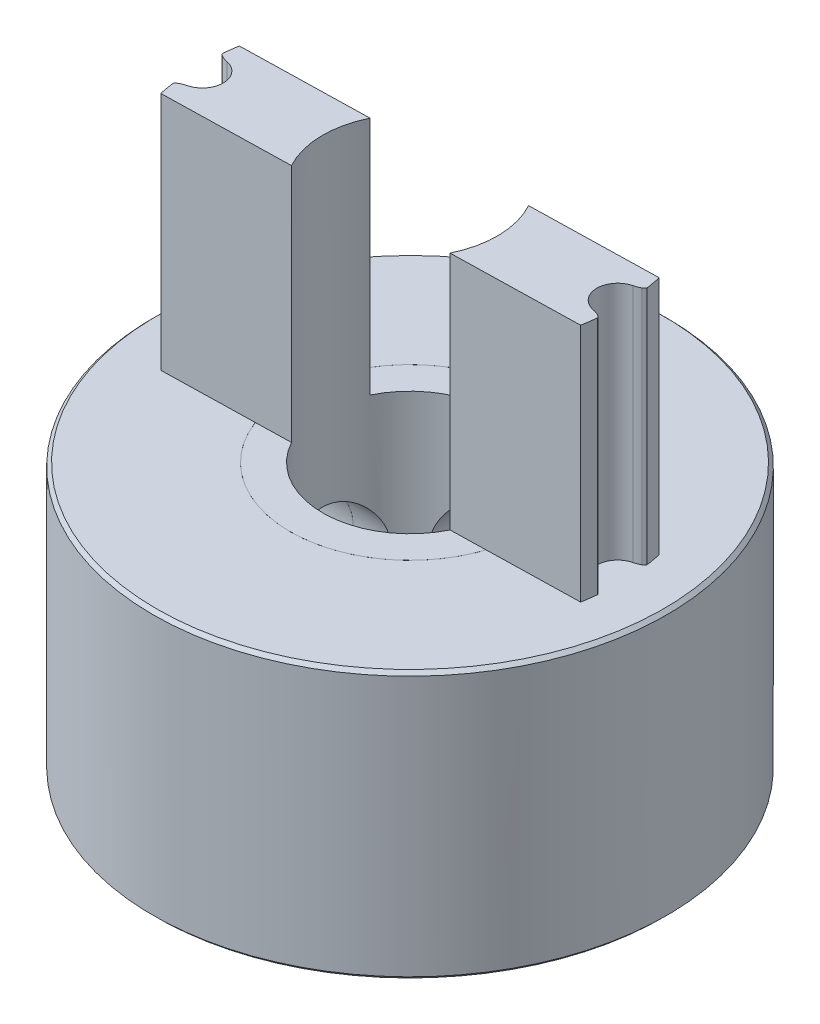
from build123d import *
from build123d.topology import SkipClean

# Parameters (mm, degrees)
P_IDAT_START            = 7.8
SKICA1_R                = 2.5
P_IDAT_VYSUNUT_M1_DEPTH = 7
SKICA2_R                = 3.5
SKICA2_R_2              = 2.5
P_IDAT_VYSUNUT_M2_DEPTH = 7.8
SKICA6_R                = 7.5
SKICA6_R_2              = 3.5
P_IDAT_VYSUNUT_M5_DEPTH = 7.8
ZKOSEN_3_SIZE           = 0.1
SKETCH19_R              = 1.5
CUT_EXTRUDE6_DEPTH      = 8
SKETCH20_R              = 1.5
CUT_EXTRUDE7_DEPTH      = 8
SKETCH21_R              = 2.55
CUT_EXTRUDE8_DEPTH      = 30
CUT_EXTRUDE9_DEPTH      = 7


with BuildPart() as part:
    # Skica1 → Přidat vysunutím1 (new body)
    with BuildSketch(Plane(origin=(0, 0, 0), x_dir=(1, 0, 0), z_dir=(0, 1, 0)).offset(P_IDAT_START)):
        with BuildLine():
            ThreePointArc((-5.730143195, 1.098270155), (-5.09645097, 1.530497044), (-5.387174672, 2.240331989))
            ThreePointArc((-5.387174672, 2.240331989), (-5.468060657, 2.292707421), (-5.540463547, 2.356296335))
            ThreePointArc((-5.540463547, 2.356296335), (-5.573874331, 2.399596558), (-5.596043873, 2.44959357))
            ThreePointArc((-5.596043873, 2.44959357), (-5.50369925, 2.650567912), (-5.404139771, 2.848067596))
            ThreePointArc((-5.404139771, 2.848067596), (-5.351227535, 2.86190541), (-5.296542742, 2.862779021))
            ThreePointArc((-5.296542742, 2.862779021), (-5.201685094, 2.845815675), (-5.110305882, 2.815228615))
            ThreePointArc((-5.110305882, 2.815228615), (-4.374063308, 3.030479148), (-4.431206919, 3.795410862))
            ThreePointArc((-4.431206919, 3.795410862), (-4.491949163, 3.870218002), (-4.541158349, 3.953068377))
            ThreePointArc((-4.541158349, 3.953068377), (-4.559553388, 4.004573836), (-4.565187949, 4.058974585))
            ThreePointArc((-4.565187949, 4.058974585), (-4.415258506, 4.221576484), (-4.259541056, 4.378644275))
            ThreePointArc((-4.259541056, 4.378644275), (-4.204942409, 4.375454038), (-4.15266412, 4.359386362))
            ThreePointArc((-4.15266412, 4.359386362), (-4.067691098, 4.313940635), (-3.990236225, 4.256612884))
            ThreePointArc((-3.990236225, 4.256612884), (-3.223511854, 4.233816838), (-3.041481758, 4.978968476))
            ThreePointArc((-3.041481758, 4.978968476), (-3.076134388, 5.06888468), (-3.097332931, 5.162886543))
            ThreePointArc((-3.097332931, 5.162886543), (-3.09891159, 5.217555525), (-3.08745962, 5.271034888))
            ThreePointArc((-3.08745962, 5.271034888), (-2.894621497, 5.379347737), (-2.697988784, 5.480608745))
            ThreePointArc((-2.697988784, 5.480608745), (-2.647048223, 5.460702739), (-2.6022938, 5.429266591))
            ThreePointArc((-2.6022938, 5.429266591), (-2.535523156, 5.359787029), (-2.479574443, 5.281330225))
            ThreePointArc((-2.479574443, 5.281330225), (-1.7574206, 5.022719037), (-1.354035171, 5.675149965))
            ThreePointArc((-1.354035171, 5.675149965), (-1.359206146, 5.771373608), (-1.350318985, 5.867325402))
            ThreePointArc((-1.350318985, 5.867325402), (-1.334926735, 5.919806527), (-1.307509232, 5.967129569))
            ThreePointArc((-1.307509232, 5.967129569), (-1.090638767, 6.010550954), (-0.872338572, 6.046093045))
            ThreePointArc((-0.872338572, 6.046093045), (-0.830042514, 6.01141981), (-0.797192832, 5.967692379))
            ThreePointArc((-0.797192832, 5.967692379), (-0.755160541, 5.880980125), (-0.726194639, 5.789074167))
            ThreePointArc((-0.726194639, 5.789074167), (-0.119300773, 5.319962501), (0.465953812, 5.815808234))
            ThreePointArc((0.465953812, 5.815808234), (0.490770664, 5.908920276), (0.528873591, 5.997429571))
            ThreePointArc((0.528873591, 5.997429571), (0.55973005, 6.04258562), (0.600429269, 6.079120034))
            ThreePointArc((0.600429269, 6.079120034), (0.820103284, 6.053399565), (1.038702217, 6.019743632))
            ThreePointArc((1.038702217, 6.019743632), (1.06821354, 5.973697225), (1.085942924, 5.921958857))
            ThreePointArc((1.085942924, 5.921958857), (1.099122448, 5.826501911), (1.098270155, 5.730143195))
            ThreePointArc((1.098270155, 5.730143195), (1.530497044, 5.09645097), (2.240331989, 5.387174672))
            ThreePointArc((2.240331989, 5.387174672), (2.292707421, 5.468060657), (2.356296335, 5.540463547))
            ThreePointArc((2.356296335, 5.540463547), (2.399596558, 5.573874331), (2.44959357, 5.596043873))
            ThreePointArc((2.44959357, 5.596043873), (2.650567912, 5.50369925), (2.848067596, 5.404139771))
            ThreePointArc((2.848067596, 5.404139771), (2.86190541, 5.351227535), (2.862779021, 5.296542742))
            ThreePointArc((2.862779021, 5.296542742), (2.845815675, 5.201685094), (2.815228615, 5.110305882))
            ThreePointArc((2.815228615, 5.110305882), (3.030479148, 4.374063308), (3.795410862, 4.431206919))
            ThreePointArc((3.795410862, 4.431206919), (3.870218002, 4.491949163), (3.953068377, 4.541158349))
            ThreePointArc((3.953068377, 4.541158349), (4.004573836, 4.559553388), (4.058974585, 4.565187949))
            ThreePointArc((4.058974585, 4.565187949), (4.221576484, 4.415258506), (4.378644275, 4.259541056))
            ThreePointArc((4.378644275, 4.259541056), (4.375454038, 4.204942409), (4.359386362, 4.15266412))
            ThreePointArc((4.359386362, 4.15266412), (4.313940635, 4.067691098), (4.256612884, 3.990236225))
            ThreePointArc((4.256612884, 3.990236225), (4.233816838, 3.223511854), (4.978968476, 3.041481758))
            ThreePointArc((4.978968476, 3.041481758), (5.06888468, 3.076134388), (5.162886543, 3.097332931))
            ThreePointArc((5.162886543, 3.097332931), (5.217555525, 3.09891159), (5.271034888, 3.08745962))
            ThreePointArc((5.271034888, 3.08745962), (5.379347737, 2.894621497), (5.480608745, 2.697988784))
            ThreePointArc((5.480608745, 2.697988784), (5.460702739, 2.647048223), (5.429266591, 2.6022938))
            ThreePointArc((5.429266591, 2.6022938), (5.359787029, 2.535523156), (5.281330225, 2.479574443))
            ThreePointArc((5.281330225, 2.479574443), (5.022719037, 1.7574206), (5.675149965, 1.354035171))
            ThreePointArc((5.675149965, 1.354035171), (5.771373608, 1.359206146), (5.867325402, 1.350318985))
            ThreePointArc((5.867325402, 1.350318985), (5.919806527, 1.334926735), (5.967129569, 1.307509232))
            ThreePointArc((5.967129569, 1.307509232), (6.010550954, 1.090638767), (6.046093045, 0.872338572))
            ThreePointArc((6.046093045, 0.872338572), (6.01141981, 0.830042514), (5.967692379, 0.797192832))
            ThreePointArc((5.967692379, 0.797192832), (5.880980125, 0.755160541), (5.789074167, 0.726194639))
            ThreePointArc((5.789074167, 0.726194639), (5.319962501, 0.119300773), (5.815808234, -0.465953812))
            ThreePointArc((5.815808234, -0.465953812), (5.908920276, -0.490770664), (5.997429571, -0.528873591))
            ThreePointArc((5.997429571, -0.528873591), (6.04258562, -0.55973005), (6.079120034, -0.600429269))
            ThreePointArc((6.079120034, -0.600429269), (6.053399565, -0.820103284), (6.019743632, -1.038702217))
            ThreePointArc((6.019743632, -1.038702217), (5.973697225, -1.06821354), (5.921958857, -1.085942924))
            ThreePointArc((5.921958857, -1.085942924), (5.826501911, -1.099122448), (5.730143195, -1.098270155))
            ThreePointArc((5.730143195, -1.098270155), (5.09645097, -1.530497044), (5.387174672, -2.240331989))
            ThreePointArc((5.387174672, -2.240331989), (5.468060657, -2.292707421), (5.540463547, -2.356296335))
            ThreePointArc((5.540463547, -2.356296335), (5.573874331, -2.399596558), (5.596043873, -2.44959357))
            ThreePointArc((5.596043873, -2.44959357), (5.50369925, -2.650567911), (5.404139771, -2.848067596))
            ThreePointArc((5.404139771, -2.848067596), (5.351227535, -2.86190541), (5.296542742, -2.862779021))
            ThreePointArc((5.296542742, -2.862779021), (5.201685094, -2.845815675), (5.110305882, -2.815228615))
            ThreePointArc((5.110305882, -2.815228615), (4.374063308, -3.030479148), (4.431206919, -3.795410862))
            ThreePointArc((4.431206919, -3.795410862), (4.491949163, -3.870218002), (4.541158349, -3.953068377))
            ThreePointArc((4.541158349, -3.953068377), (4.559553388, -4.004573836), (4.565187949, -4.058974585))
            ThreePointArc((4.565187949, -4.058974585), (4.415258506, -4.221576484), (4.259541056, -4.378644275))
            ThreePointArc((4.259541056, -4.378644275), (4.204942409, -4.375454038), (4.15266412, -4.359386362))
            ThreePointArc((4.15266412, -4.359386362), (4.067691098, -4.313940635), (3.990236225, -4.256612884))
            ThreePointArc((3.990236225, -4.256612884), (3.223511854, -4.233816838), (3.041481758, -4.978968476))
            ThreePointArc((3.041481758, -4.978968476), (3.076134388, -5.06888468), (3.097332931, -5.162886543))
            ThreePointArc((3.097332931, -5.162886543), (3.09891159, -5.217555525), (3.08745962, -5.271034888))
            ThreePointArc((3.08745962, -5.271034888), (2.894621497, -5.379347737), (2.697988784, -5.480608745))
            ThreePointArc((2.697988784, -5.480608745), (2.647048223, -5.460702739), (2.6022938, -5.429266591))
            ThreePointArc((2.6022938, -5.429266591), (2.535523156, -5.359787029), (2.479574443, -5.281330225))
            ThreePointArc((2.479574443, -5.281330225), (1.7574206, -5.022719037), (1.354035171, -5.675149965))
            ThreePointArc((1.354035171, -5.675149965), (1.359206146, -5.771373608), (1.350318985, -5.867325402))
            ThreePointArc((1.350318985, -5.867325402), (1.334926735, -5.919806527), (1.307509232, -5.967129569))
            ThreePointArc((1.307509232, -5.967129569), (1.090638767, -6.010550954), (0.872338572, -6.046093045))
            ThreePointArc((0.872338572, -6.046093045), (0.830042514, -6.01141981), (0.797192832, -5.967692379))
            ThreePointArc((0.797192832, -5.967692379), (0.755160541, -5.880980125), (0.726194639, -5.789074167))
            ThreePointArc((0.726194639, -5.789074167), (0.119300773, -5.319962501), (-0.465953812, -5.815808234))
            ThreePointArc((-0.465953812, -5.815808234), (-0.490770664, -5.908920276), (-0.528873591, -5.997429571))
            ThreePointArc((-0.528873591, -5.997429571), (-0.55973005, -6.04258562), (-0.600429269, -6.079120034))
            ThreePointArc((-0.600429269, -6.079120034), (-0.820103284, -6.053399565), (-1.038702217, -6.019743632))
            ThreePointArc((-1.038702217, -6.019743632), (-1.06821354, -5.973697225), (-1.085942924, -5.921958857))
            ThreePointArc((-1.085942924, -5.921958857), (-1.099122448, -5.826501911), (-1.098270155, -5.730143195))
            ThreePointArc((-1.098270155, -5.730143195), (-1.530497044, -5.09645097), (-2.240331989, -5.387174672))
            ThreePointArc((-2.240331989, -5.387174672), (-2.292707421, -5.468060657), (-2.356296335, -5.540463547))
            ThreePointArc((-2.356296335, -5.540463547), (-2.399596558, -5.573874331), (-2.44959357, -5.596043873))
            ThreePointArc((-2.44959357, -5.596043873), (-2.650567912, -5.50369925), (-2.848067596, -5.404139771))
            ThreePointArc((-2.848067596, -5.404139771), (-2.86190541, -5.351227535), (-2.862779021, -5.296542742))
            ThreePointArc((-2.862779021, -5.296542742), (-2.845815675, -5.201685094), (-2.815228615, -5.110305882))
            ThreePointArc((-2.815228615, -5.110305882), (-3.030479148, -4.374063308), (-3.795410862, -4.431206919))
            ThreePointArc((-3.795410862, -4.431206919), (-3.870218002, -4.491949163), (-3.953068377, -4.541158349))
            ThreePointArc((-3.953068377, -4.541158349), (-4.004573836, -4.559553388), (-4.058974585, -4.565187949))
            ThreePointArc((-4.058974585, -4.565187949), (-4.221576484, -4.415258506), (-4.378644275, -4.259541056))
            ThreePointArc((-4.378644275, -4.259541056), (-4.375454038, -4.204942409), (-4.359386362, -4.15266412))
            ThreePointArc((-4.359386362, -4.15266412), (-4.313940635, -4.067691098), (-4.256612884, -3.990236225))
            ThreePointArc((-4.256612884, -3.990236225), (-4.233816838, -3.223511854), (-4.978968476, -3.041481758))
            ThreePointArc((-4.978968476, -3.041481758), (-5.06888468, -3.076134388), (-5.162886543, -3.097332931))
            ThreePointArc((-5.162886543, -3.097332931), (-5.217555525, -3.09891159), (-5.271034888, -3.08745962))
            ThreePointArc((-5.271034888, -3.08745962), (-5.379347737, -2.894621497), (-5.480608745, -2.697988784))
            ThreePointArc((-5.480608745, -2.697988784), (-5.460702739, -2.647048223), (-5.429266591, -2.6022938))
            ThreePointArc((-5.429266591, -2.6022938), (-5.359787029, -2.535523156), (-5.281330225, -2.479574443))
            ThreePointArc((-5.281330225, -2.479574443), (-5.022719037, -1.7574206), (-5.675149965, -1.354035171))
            ThreePointArc((-5.675149965, -1.354035171), (-5.771373608, -1.359206146), (-5.867325402, -1.350318985))
            ThreePointArc((-5.867325402, -1.350318985), (-5.919806527, -1.334926735), (-5.967129569, -1.307509232))
            ThreePointArc((-5.967129569, -1.307509232), (-6.010550954, -1.090638767), (-6.046093045, -0.872338572))
            ThreePointArc((-6.046093045, -0.872338572), (-6.01141981, -0.830042514), (-5.967692379, -0.797192832))
            ThreePointArc((-5.967692379, -0.797192832), (-5.880980125, -0.755160541), (-5.789074167, -0.726194639))
            ThreePointArc((-5.789074167, -0.726194639), (-5.319962501, -0.119300773), (-5.815808234, 0.465953812))
            ThreePointArc((-5.815808234, 0.465953812), (-5.908920276, 0.490770664), (-5.997429571, 0.528873591))
            ThreePointArc((-5.997429571, 0.528873591), (-6.04258562, 0.55973005), (-6.079120034, 0.600429269))
            ThreePointArc((-6.079120034, 0.600429269), (-6.053399565, 0.820103284), (-6.019743632, 1.038702217))
            ThreePointArc((-6.019743632, 1.038702217), (-5.973697225, 1.06821354), (-5.921958857, 1.085942924))
            ThreePointArc((-5.921958857, 1.085942924), (-5.826501911, 1.099122448), (-5.730143195, 1.098270155))
        make_face()
        with Locations(Location((0, 0, 0), (0, 0, 270))):
            Circle(SKICA1_R, mode=Mode.SUBTRACT)
    extrude(amount=P_IDAT_VYSUNUT_M1_DEPTH)

    # Skica2 → Přidat vysunutím2 (add)
    with SkipClean():  # the faces are left unmerged after this step: merging them gives an invalid solid
        with BuildSketch(Plane.XZ.offset(-7.8).offset(P_IDAT_START)):
            with Locations(Location((0, 0, 0), (0, 0, 90))):
                Circle(SKICA2_R)
            with Locations(Location((0, 0, 0), (0, 0, 270))):
                Circle(SKICA2_R_2, mode=Mode.SUBTRACT)
        extrude(amount=-P_IDAT_VYSUNUT_M2_DEPTH)


with BuildPart() as body_2:
    # Skica6 → Přidat vysunutím5 (new body)
    with BuildSketch(Plane.XZ):
        with Locations(Location((0, 0, 0), (0, 0, 270))):
            Circle(SKICA6_R)
        with Locations(Location((0, 0, 0), (0, 0, 270))):
            Circle(SKICA6_R_2, mode=Mode.SUBTRACT)
    extrude(amount=-P_IDAT_VYSUNUT_M5_DEPTH)

    # Zkosení3
    zkosen_3_edges = [body_2.edges().sort_by_distance(p)[0] for p in [
        (0, 0, 7.5),
        (0, 7.8, 7.5),
    ]]
    chamfer(zkosen_3_edges, length=ZKOSEN_3_SIZE)


with BuildPart() as cut_extrude6_tool:
    # Sketch19 → Cut-Extrude6 (new body)
    with SkipClean():  # the faces are left unmerged after this step: merging them gives an invalid solid
        with BuildSketch(Plane(origin=(0, 0, -7.5), x_dir=(-1, 0, 0), z_dir=(0, 0, -1))):
            with Locations(Location((0, 3.9, 0), (0, 0, 90))):
                Circle(SKETCH19_R)
        extrude(amount=-CUT_EXTRUDE6_DEPTH)


with BuildPart() as part_1:
    with SkipClean():  # the faces are left unmerged after this step: merging them gives an invalid solid
        add(part.part)

        # Cut-Extrude6: cut by cut_extrude6_tool
        add(cut_extrude6_tool.part, mode=Mode.SUBTRACT)


with BuildPart() as body_2_1:
    with SkipClean():  # the faces are left unmerged after this step: merging them gives an invalid solid
        add(body_2.part)

        # Cut-Extrude6: cut by cut_extrude6_tool
        add(cut_extrude6_tool.part, mode=Mode.SUBTRACT)


with BuildPart() as cut_extrude7_tool:
    # Sketch20 → Cut-Extrude7 (new body)
    with SkipClean():  # the faces are left unmerged after this step: merging them gives an invalid solid
        with BuildSketch(Plane.ZY.offset(7.5)):
            with Locations((0, 3.9)):
                Circle(SKETCH20_R)
        extrude(amount=-CUT_EXTRUDE7_DEPTH)


with BuildPart() as part_2:
    with SkipClean():  # the faces are left unmerged after this step: merging them gives an invalid solid
        add(part_1.part)

        # Cut-Extrude7: cut by cut_extrude7_tool
        add(cut_extrude7_tool.part, mode=Mode.SUBTRACT)

    # Sketch21 → Cut-Extrude8 (cut)
    with BuildSketch(Plane(origin=(0, 16, 0), x_dir=(1, 0, 0), z_dir=(0, 1, 0))):
        with Locations(Location((0, 0, 0), (0, 0, 270))):
            Circle(SKETCH21_R)
    extrude(amount=-CUT_EXTRUDE8_DEPTH, mode=Mode.SUBTRACT)

    # Sketch23 → Cut-Extrude9 (cut)
    with BuildSketch(Plane(origin=(0, 14.8, 0), x_dir=(1, 0, 0), z_dir=(0, 1, 0))):
        Polygon((-5.967129569, -1.307509232), (6.019743632, -1.038702217), (7.907852056, 0.53393135), (5.967129569, 1.307509232), (-6.019743632, 1.038702217), (-9.071782104, 9.595287149), (10.324887202, 9.812495092), (9.130243516, -12.060344764), (-8.831223903, -11.886560162), align=None)
    extrude(amount=-CUT_EXTRUDE9_DEPTH, mode=Mode.SUBTRACT)


with BuildPart() as body_2_2:
    with SkipClean():  # the faces are left unmerged after this step: merging them gives an invalid solid
        add(body_2_1.part)

        # Cut-Extrude7: cut by cut_extrude7_tool
        add(cut_extrude7_tool.part, mode=Mode.SUBTRACT)


solid = Compound([part_2.part, body_2_2.part])
